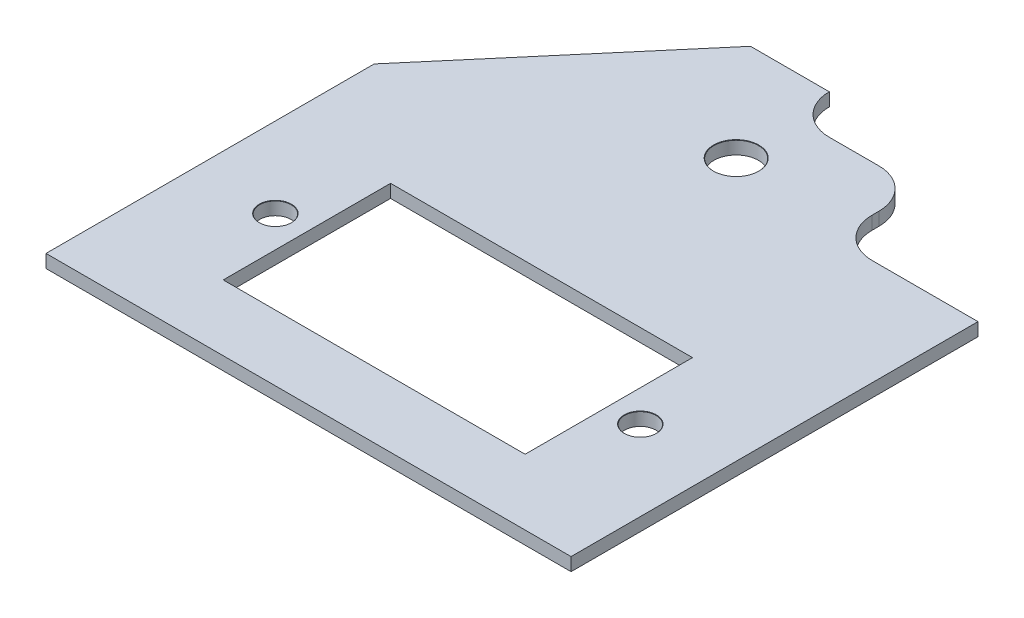
from build123d import *

# Parameters (mm, degrees)
BOSS_EXTRUDE1_DEPTH           = 1
SKETCH4_W                     = 40
SKETCH4_H                     = 25
BOSS_EXTRUDE2_DEPTH           = 1
SKETCH5_W                     = 8.058679656
SKETCH5_H                     = 6
BOSS_EXTRUDE3_DEPTH           = 1
SKETCH8_W                     = 23
SKETCH8_H                     = 12.75
CUT_EXTRUDE1_DEPTH            = 1
M2_CLEARANCE_HOLE1_AT_2_COUNT = 2
M2_CLEARANCE_HOLE1_AT_2_PITCH = 27.8


with BuildPart() as part:
    # Sketch1 → Boss-Extrude1 (new body)
    with BuildSketch(Plane(origin=(0, 0, 0), x_dir=(1, 0, 0), z_dir=(0, 1, 0))):
        with BuildLine():
            Line((-3, 0), (-9, 0))
            Line((-9, 0), (-9, -15.5))
            Line((-9, -15.5), (9.77, -15.5))
            Line((9.77, -15.5), (9.77, -9.5))
            ThreePointArc((9.77, -9.5), (7.648679656, -8.621320344), (6.77, -6.5))
            Line((6.77, -6.5), (6.77, -6))
            ThreePointArc((6.77, -6), (5.891320344, -3.878679656), (3.77, -3))
            Line((3.77, -3), (0, -3))
            ThreePointArc((0, -3), (-2.121320344, -2.121320344), (-3, 0))
        make_face()
    extrude(amount=BOSS_EXTRUDE1_DEPTH)

    # Sketch3 → M3 Clearance Hole1 (revolve, cut)
    with BuildSketch(Plane(origin=(-2.171320344, 1, 7.921320344), x_dir=(0, 0, 1), z_dir=(1, 0, 0))):
        Polygon((0, 0), (0, 1), (1.7, 1), (1.7, 0.025), (1.725, 0), align=None)
    revolve(axis=Axis((-2.171320344, 7.35, 7.921320344), (0, -1, 0)), mode=Mode.SUBTRACT)

    # Sketch4 → Boss-Extrude2 (add)
    with BuildSketch(Plane(origin=(0, 1, 0), x_dir=(1, 0, 0), z_dir=(0, 1, 0))):
        with Locations((-2.171320344, -28)):
            Rectangle(SKETCH4_W, SKETCH4_H)
    extrude(amount=-BOSS_EXTRUDE2_DEPTH)

    # Sketch5 → Boss-Extrude3 (add)
    with BuildSketch(Plane(origin=(0, 1, 0), x_dir=(1, 0, 0), z_dir=(0, 1, 0))):
        with Locations((13.799339828, -12.5)):
            Rectangle(SKETCH5_W, SKETCH5_H)
        Polygon((-9, -15.5), (-22.171320344, -15.5), (-9, 0), align=None)
    extrude(amount=-BOSS_EXTRUDE3_DEPTH)

    # Sketch8 → Cut-Extrude1 (cut)
    with BuildSketch(Plane(origin=(0, 1, 0), x_dir=(1, 0, 0), z_dir=(0, 1, 0))):
        with Locations((-2.171320344, -29.125)):
            Rectangle(SKETCH8_W, SKETCH8_H)
    extrude(amount=-CUT_EXTRUDE1_DEPTH, mode=Mode.SUBTRACT)

    # Sketch10 → M2 Clearance Hole1 (revolve, cut)
    with BuildSketch(Plane(origin=(-16.071320344, 1, 29.125), x_dir=(0, 0, 1), z_dir=(1, 0, 0))):
        Polygon((0, 0), (0, 1), (1.2, 1), (1.2, 0.025), (1.225, 0), align=None)
    m2_clearance_hole1 = revolve(axis=Axis((-16.071320344, 7.35, 29.125), (0, -1, 0)), mode=Mode.SUBTRACT)

    # M2 Clearance Hole1 at 2: M2 Clearance Hole1 ×2
    with Locations(*[(i * M2_CLEARANCE_HOLE1_AT_2_PITCH, 0, 0) for i in range(1, M2_CLEARANCE_HOLE1_AT_2_COUNT)]):
        add(m2_clearance_hole1, mode=Mode.SUBTRACT)


solid = part.part
